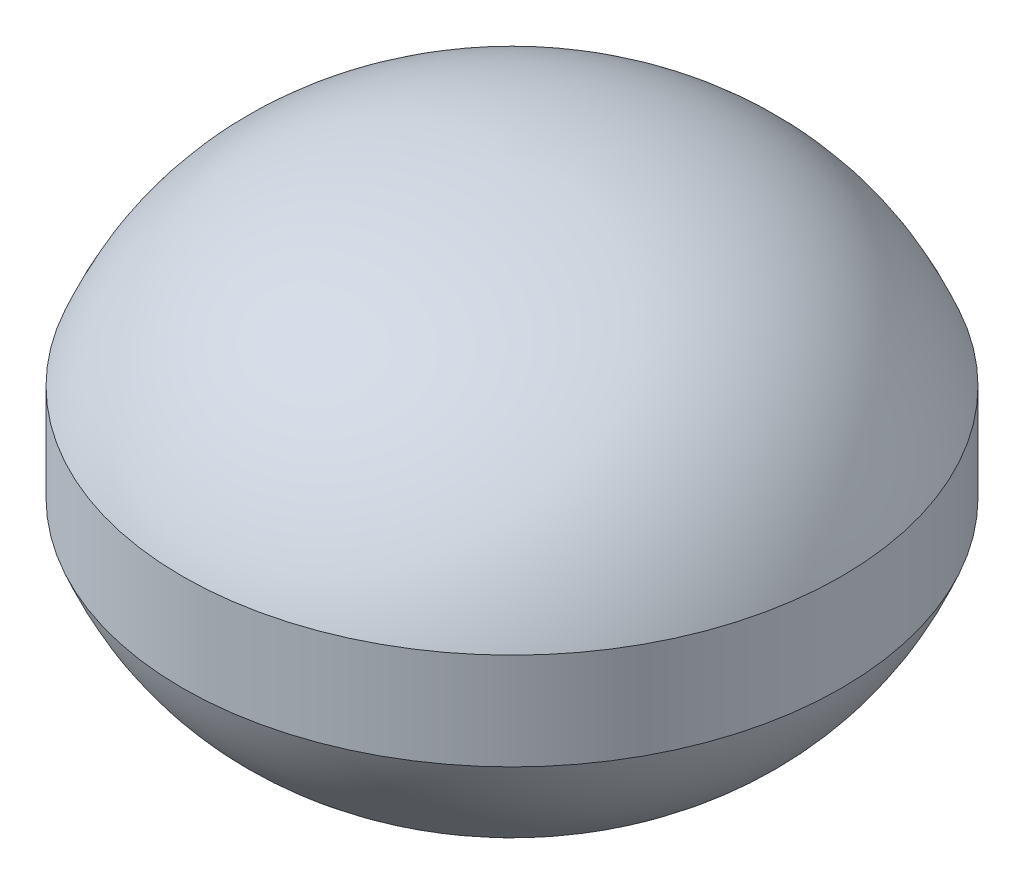
from build123d import *

# Parameters (mm, degrees)
SKETCH4_R           = 450.85
BOSS_EXTRUDE2_DEPTH = 66.2


with BuildPart() as part:
    # Sketch4 → Boss-Extrude2 (new, symmetric)
    with BuildSketch(Plane(origin=(0, 0, 0), x_dir=(1, 0, 0), z_dir=(0, 1, 0))):
        with Locations(Location((0, 0, 0), (0, 0, 270))):
            Circle(SKETCH4_R)
    extrude(amount=BOSS_EXTRUDE2_DEPTH, both=True)

    # Sketch10 → Revolve7 (revolve)
    with BuildSketch(Plane.XY, mode=Mode.PRIVATE) as revolve7_sk:
        with BuildLine():
            Line((-450.85, 66.2), (0, 66.2))
            Line((0, 66.2), (0, 336.55))
            add(Edge.make_bspline(
                [(-450.85, 66.2), (-347.711285852, 328.659338565), (0, 336.55)],
                knots=[0, 0, 0, 1, 1, 1], degree=2))
        make_face()
        with BuildLine():
            Line((-450.85, -66.2), (0, -66.2))
            Line((0, -66.2), (0, -336.55))
            add(Edge.make_bspline(
                [(-450.85, -66.2), (-347.711285852, -328.659338565), (0, -336.55)],
                knots=[0, 0, 0, 1, 1, 1], degree=2))
        make_face()
    revolve(revolve7_sk.sketch.rotate(Axis((0, 0, 0), (0, 1, 0)), 180), axis=Axis((0, 0, 0), (0, 1, 0)))


solid = part.part
